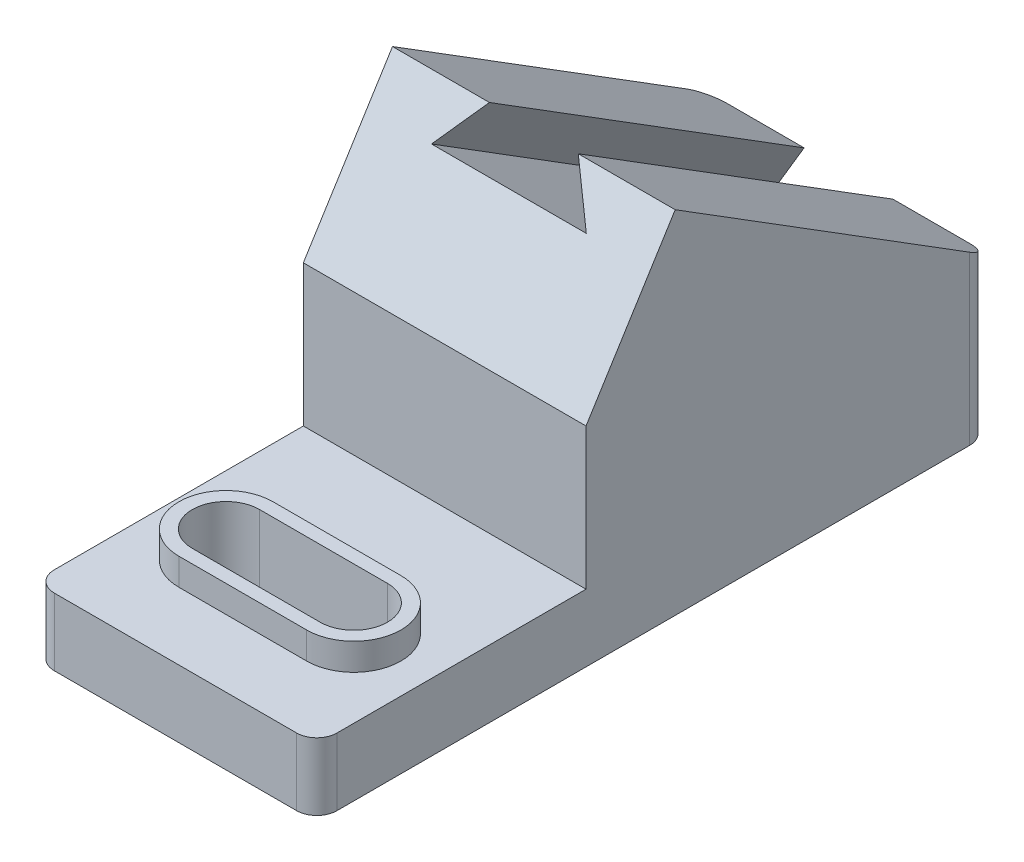
from build123d import *

# Parameters (mm, degrees)
BOSS_EXTRUDE1_DEPTH = 21
BOSS_EXTRUDE2_DEPTH = 4
CUT_EXTRUDE1_DEPTH  = 111.552889986
CUT_EXTRUDE2_REACH  = 86.863
FILLET1_R           = 3


with BuildPart() as part:
    # Sketch1 → Boss-Extrude1 (new, symmetric)
    with BuildSketch(Plane(origin=(0, 0, 0), x_dir=(0, 0, -1), z_dir=(1, 0, 0))):
        Polygon((0, 0), (0, 22.987298969), (-46.752018394, 52.201202404), (-60, 31), (-60, 10), (-100, 10), (-100, 0), align=None)
    extrude(amount=BOSS_EXTRUDE1_DEPTH, both=True)

    # Sketch2 → Boss-Extrude2 (add)
    with BuildSketch(Plane(origin=(0, 10, 0), x_dir=(1, 0, 0), z_dir=(0, 1, 0))):
        with BuildLine():
            Line((9.5, -76), (-9.5, -76))
            ThreePointArc((-9.5, -76), (-16.5, -83), (-9.5, -90))
            Line((-9.5, -90), (9.5, -90))
            ThreePointArc((9.5, -90), (16.5, -83), (9.5, -76))
        make_face()
        with BuildLine():
            ThreePointArc((-9.5, -88), (-14.5, -83), (-9.5, -78))
            Line((-9.5, -78), (9.5, -78))
            ThreePointArc((9.5, -78), (14.5, -83), (9.5, -88))
            Line((9.5, -88), (-9.5, -88))
        make_face(mode=Mode.SUBTRACT)
    extrude(amount=BOSS_EXTRUDE2_DEPTH)

    # Sketch2<3> → Cut-Extrude1 (cut, through all)
    with BuildSketch(Plane(origin=(0, 10, 0), x_dir=(1, 0, 0), z_dir=(0, 1, 0))):
        with BuildLine():
            Line((9.5, -78), (-9.5, -78))
            ThreePointArc((-9.5, -78), (-14.5, -83), (-9.5, -88))
            Line((-9.5, -88), (9.5, -88))
            ThreePointArc((9.5, -88), (14.5, -83), (9.5, -78))
        make_face()
    extrude(amount=-CUT_EXTRUDE1_DEPTH, mode=Mode.SUBTRACT)

    # Cut-Extrude2: up to this plane
    cut_extrude2_end = Plane(origin=(21, 0, 0), z_dir=(0, 0, 1))
    # Sketch3 → Cut-Extrude2 (cut, up to the surface)
    with BuildSketch(Plane(origin=(0, 35.669068614, 57.082442121), x_dir=(1, 0, 0), z_dir=(0, 0.5299192642332053, 0.8480480961564258)), mode=Mode.PRIVATE) as cut_extrude2_sk1:
        Polygon((-6.598547233, 19.494335127), (-11.5, 12.494335127), (11.5, 12.494335127), (6.598547233, 19.494335127), align=None)
    cut_extrude2_tool1 = split(extrude(cut_extrude2_sk1.sketch, amount=-CUT_EXTRUDE2_REACH, mode=Mode.PRIVATE), bisect_by=cut_extrude2_end, keep=Keep.BOTH, mode=Mode.PRIVATE)
    add(cut_extrude2_tool1.solids().sort_by_distance((0, 48.965087, 48.774167))[0], mode=Mode.SUBTRACT)

    # Fillet1
    fillet1_edges = [part.edges().sort_by_distance(p)[0] for p in [
        (-21, 11.493649485, 0),
        (21, 11.493649485, 0),
        (-21, 5, 100),
        (21, 5, 100),
    ]]
    fillet(fillet1_edges, radius=FILLET1_R)


solid = part.part
